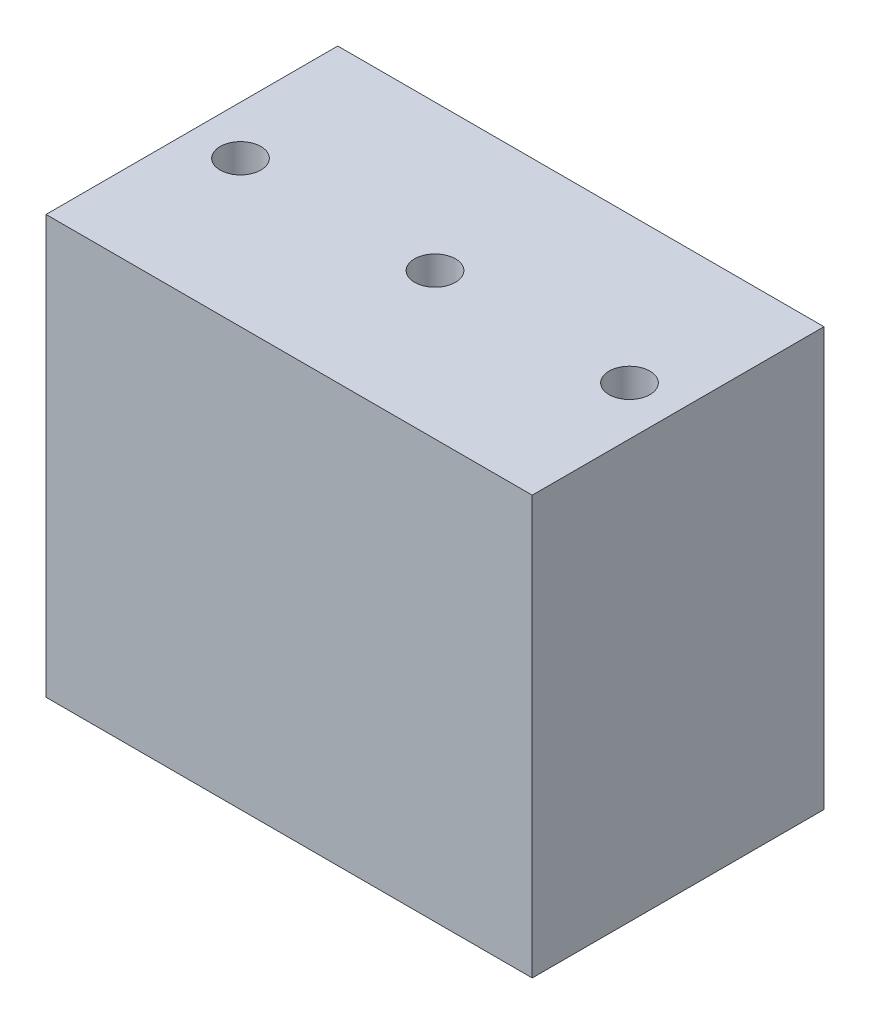
from build123d import *

# Parameters (mm, degrees)
SKETCH1_W           = 50
SKETCH1_H           = 30
SKETCH1_R           = 2.1
BOSS_EXTRUDE1_DEPTH = 43


with BuildPart() as part:
    # Sketch1 → Boss-Extrude1 (new body)
    with BuildSketch(Plane(origin=(0, 0, 0), x_dir=(1, 0, 0), z_dir=(0, 1, 0))):
        Rectangle(SKETCH1_W, SKETCH1_H)
        with Locations(Location((-20, 0, 0), (0, 0, 270))):
            Circle(SKETCH1_R, mode=Mode.SUBTRACT)
        with Locations(Location((0, 0, 0), (0, 0, 270))):
            Circle(SKETCH1_R, mode=Mode.SUBTRACT)
        with Locations(Location((20, 0, 0), (0, 0, 270))):
            Circle(SKETCH1_R, mode=Mode.SUBTRACT)
    extrude(amount=BOSS_EXTRUDE1_DEPTH)


solid = part.part
